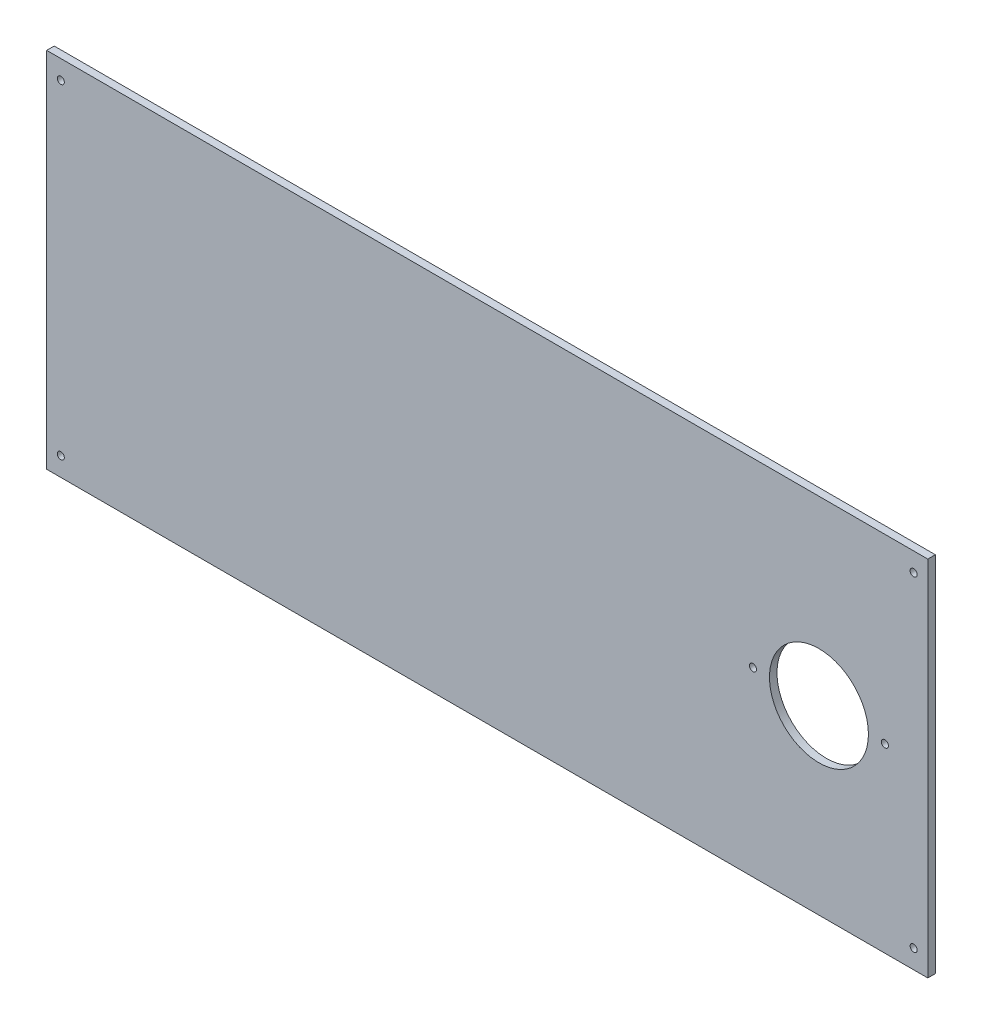
from build123d import *

# Parameters (mm, degrees)
KEEPOUTLAYER_W      = 186.9999816
KEEPOUTLAYER_H      = 76.9999984
EXTRUDE_1_DEPTH     = 1.6
VIAHOLELAYER_R      = 0.7499985
VIAHOLELAYER_R_2    = 10.5
CUT_EXTRUDE_1_DEPTH = 203.32893066


with BuildPart() as part:
    # KeepOutLayer → Бобышка-Вытянуть1 (new body)
    with BuildSketch(Plane.XY):
        with Locations((93.56941662, -38.56797722)):
            Rectangle(KEEPOUTLAYER_W, KEEPOUTLAYER_H)
    extrude(amount=-EXTRUDE_1_DEPTH)

    # ViaHoleLayer → Вырез-Вытянуть1 (cut, through all)
    with BuildSketch(Plane.XY):
        with Locations((3.0693995, -73.06799966)):
            Circle(VIAHOLELAYER_R)
        with Locations((3.0693995, -4.0680005)):
            Circle(VIAHOLELAYER_R)
        with Locations((184.06940072, -73.06799966)):
            Circle(VIAHOLELAYER_R)
        with Locations((184.06940072, -4.0680005)):
            Circle(VIAHOLELAYER_R)
        with Locations((149.96940542, -38.56797722)):
            Circle(VIAHOLELAYER_R)
        with Locations((177.96940022, -38.56797722)):
            Circle(VIAHOLELAYER_R)
        with Locations((163.96937742, -38.56797722)):
            Circle(VIAHOLELAYER_R_2)
    extrude(amount=-CUT_EXTRUDE_1_DEPTH, mode=Mode.SUBTRACT)


solid = part.part
